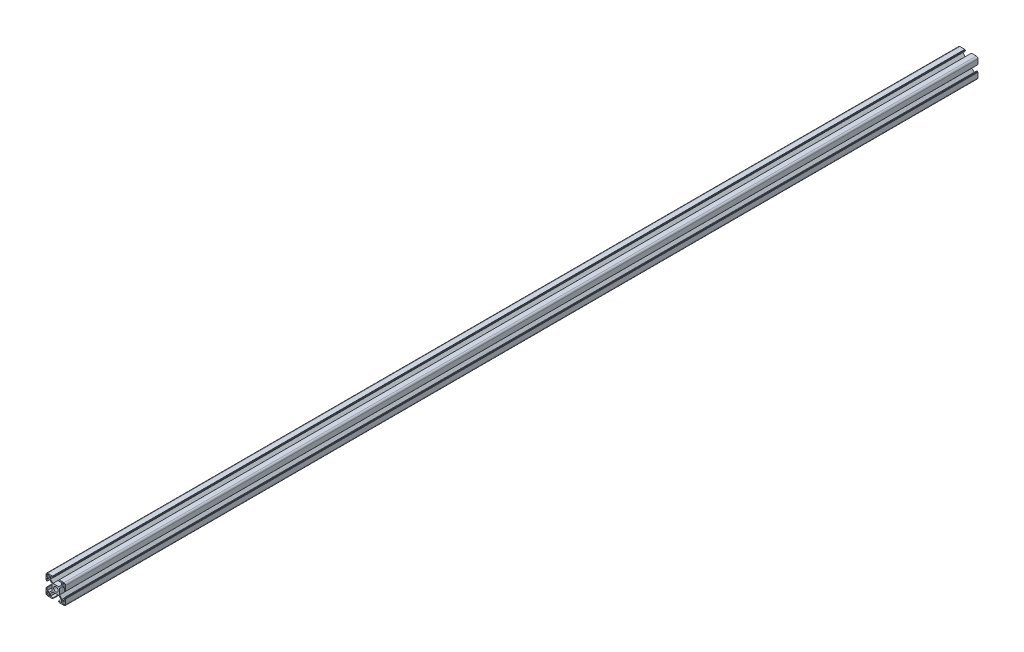
from build123d import *

# Parameters (mm, degrees)
SKETCH1_R      = 3.4
EXTRUDE1_DEPTH = 1390
EXTRUDE2_DEPTH = 1391.161861079


with BuildPart() as part:
    # Sketch1 → Extrude1 (new body)
    with BuildSketch(Plane.XY):
        with BuildLine():
            Line((-5.1, 14.2), (-5.1, 15))
            Line((-5.1, 15), (-12.5, 15))
            ThreePointArc((-12.5, 15), (-14.267766953, 14.267766953), (-15, 12.5))
            Line((-15, 12.5), (-15, 5.1))
            Line((-15, 5.1), (-14.2, 5.1))
            Line((-14.2, 5.1), (-14.2, 4.1))
            Line((-14.2, 4.1), (-13.2, 4.1))
            Line((-13.2, 4.1), (-13.2, 8.25))
            Line((-13.2, 8.25), (-9.522792206, 8.25))
            Line((-9.522792206, 8.25), (-5.7, 4.427207794))
            Line((-5.7, 4.427207794), (-5.7, -4.427207794))
            Line((-5.7, -4.427207794), (-9.522792206, -8.25))
            Line((-9.522792206, -8.25), (-13.2, -8.25))
            Line((-13.2, -8.25), (-13.2, -4.1))
            Line((-13.2, -4.1), (-14.2, -4.1))
            Line((-14.2, -4.1), (-14.2, -5.1))
            Line((-14.2, -5.1), (-15, -5.1))
            Line((-15, -5.1), (-15, -12.5))
            ThreePointArc((-15, -12.5), (-14.267766953, -14.267766953), (-12.5, -15))
            Line((-12.5, -15), (-5.1, -15))
            Line((-5.1, -15), (-5.1, -14.2))
            Line((-5.1, -14.2), (-4.1, -14.2))
            Line((-4.1, -14.2), (-4.1, -13.2))
            Line((-4.1, -13.2), (-8.25, -13.2))
            Line((-8.25, -13.2), (-8.25, -9.522792206))
            Line((-8.25, -9.522792206), (-4.427207794, -5.7))
            Line((-4.427207794, -5.7), (4.427207794, -5.7))
            Line((4.427207794, -5.7), (8.25, -9.522792206))
            Line((8.25, -9.522792206), (8.25, -13.2))
            Line((8.25, -13.2), (4.1, -13.2))
            Line((4.1, -13.2), (4.1, -14.2))
            Line((4.1, -14.2), (5.1, -14.2))
            Line((5.1, -14.2), (5.1, -15))
            Line((5.1, -15), (12.5, -15))
            ThreePointArc((12.5, -15), (14.267766953, -14.267766953), (15, -12.5))
            Line((15, -12.5), (15, -5.1))
            Line((15, -5.1), (14.2, -5.1))
            Line((14.2, -5.1), (14.2, -4.1))
            Line((14.2, -4.1), (13.2, -4.1))
            Line((13.2, -4.1), (13.2, -8.25))
            Line((13.2, -8.25), (9.522792206, -8.25))
            Line((9.522792206, -8.25), (5.7, -4.427207794))
            Line((5.7, -4.427207794), (5.7, 4.427207794))
            Line((5.7, 4.427207794), (9.522792206, 8.25))
            Line((9.522792206, 8.25), (13.2, 8.25))
            Line((13.2, 8.25), (13.2, 4.1))
            Line((13.2, 4.1), (14.2, 4.1))
            Line((14.2, 4.1), (14.2, 5.1))
            Line((14.2, 5.1), (15, 5.1))
            Line((15, 5.1), (15, 12.5))
            ThreePointArc((15, 12.5), (14.267766953, 14.267766953), (12.5, 15))
            Line((12.5, 15), (5.1, 15))
            Line((5.1, 15), (5.1, 14.2))
            Line((5.1, 14.2), (4.1, 14.2))
            Line((4.1, 14.2), (4.1, 13.2))
            Line((4.1, 13.2), (8.25, 13.2))
            Line((8.25, 13.2), (8.25, 9.522792206))
            Line((8.25, 9.522792206), (4.427207794, 5.7))
            Line((4.427207794, 5.7), (-4.427207794, 5.7))
            Line((-4.427207794, 5.7), (-8.25, 9.522792206))
            Line((-8.25, 9.522792206), (-8.25, 13.2))
            Line((-8.25, 13.2), (-4.1, 13.2))
            Line((-4.1, 13.2), (-4.1, 14.2))
            Line((-4.1, 14.2), (-5.1, 14.2))
        make_face()
        Circle(SKETCH1_R, mode=Mode.SUBTRACT)
    extrude(amount=EXTRUDE1_DEPTH)

    # Sketch2 → Extrude2 (cut, through all)
    with BuildSketch(Plane.XY.offset(1390)):
        with BuildLine():
            Line((13.7, 12.7), (13.7, 10.55))
            ThreePointArc((13.7, 10.55), (13.407106781, 9.842893219), (12.7, 9.55))
            Line((12.7, 9.55), (10.55, 9.55))
            ThreePointArc((10.55, 9.55), (9.842893219, 9.842893219), (9.55, 10.55))
            Line((9.55, 10.55), (9.55, 12.7))
            ThreePointArc((9.55, 12.7), (9.842893219, 13.407106781), (10.55, 13.7))
            Line((10.55, 13.7), (12.7, 13.7))
            ThreePointArc((12.7, 13.7), (13.407106781, 13.407106781), (13.7, 12.7))
        make_face()
        with BuildLine():
            Line((-12.7, 13.7), (-10.55, 13.7))
            ThreePointArc((-10.55, 13.7), (-9.842893219, 13.407106781), (-9.55, 12.7))
            Line((-9.55, 12.7), (-9.55, 10.55))
            ThreePointArc((-9.55, 10.55), (-9.842893219, 9.842893219), (-10.55, 9.55))
            Line((-10.55, 9.55), (-12.7, 9.55))
            ThreePointArc((-12.7, 9.55), (-13.407106781, 9.842893219), (-13.7, 10.55))
            Line((-13.7, 10.55), (-13.7, 12.7))
            ThreePointArc((-13.7, 12.7), (-13.407106781, 13.407106781), (-12.7, 13.7))
        make_face()
        with BuildLine():
            Line((12.7, -13.7), (10.55, -13.7))
            ThreePointArc((10.55, -13.7), (9.842893219, -13.407106781), (9.55, -12.7))
            Line((9.55, -12.7), (9.55, -10.55))
            ThreePointArc((9.55, -10.55), (9.842893219, -9.842893219), (10.55, -9.55))
            Line((10.55, -9.55), (12.7, -9.55))
            ThreePointArc((12.7, -9.55), (13.407106781, -9.842893219), (13.7, -10.55))
            Line((13.7, -10.55), (13.7, -12.7))
            ThreePointArc((13.7, -12.7), (13.407106781, -13.407106781), (12.7, -13.7))
        make_face()
        with BuildLine():
            Line((-13.7, -12.7), (-13.7, -10.55))
            ThreePointArc((-13.7, -10.55), (-13.407106781, -9.842893219), (-12.7, -9.55))
            Line((-12.7, -9.55), (-10.55, -9.55))
            ThreePointArc((-10.55, -9.55), (-9.842893219, -9.842893219), (-9.55, -10.55))
            Line((-9.55, -10.55), (-9.55, -12.7))
            ThreePointArc((-9.55, -12.7), (-9.842893219, -13.407106781), (-10.55, -13.7))
            Line((-10.55, -13.7), (-12.7, -13.7))
            ThreePointArc((-12.7, -13.7), (-13.407106781, -13.407106781), (-13.7, -12.7))
        make_face()
    extrude(amount=-EXTRUDE2_DEPTH, mode=Mode.SUBTRACT)


solid = part.part
